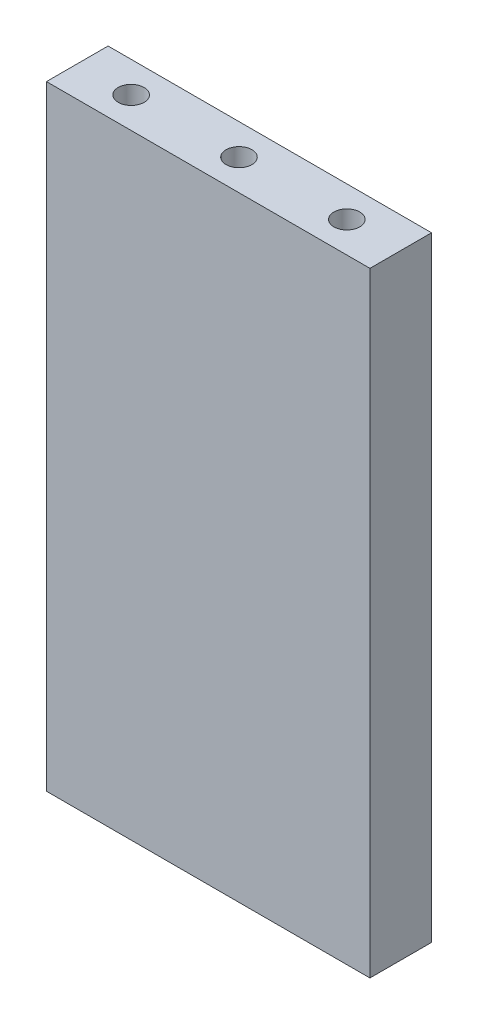
from build123d import *

# Parameters (mm, degrees)
SKETCH1_W                 = 50
SKETCH1_H                 = 95
BOSS_EXTRUDE1_DEPTH       = 9.525
F_4_0MM_DOWEL_HOLE1_D     = 4
F_4_0MM_DOWEL_HOLE1_DEPTH = 3.2
F_4_0MM_DOWEL_HOLE1_TIP   = 1.201721238
F_4_0MM_DOWEL_HOLE2_D     = 4
F_4_0MM_DOWEL_HOLE2_DEPTH = 3.2
F_4_0MM_DOWEL_HOLE2_TIP   = 1.201721238


with BuildPart() as part:
    # Sketch1 → Boss-Extrude1 (new body)
    with BuildSketch(Plane.XY):
        Rectangle(SKETCH1_W, SKETCH1_H)
    extrude(amount=-BOSS_EXTRUDE1_DEPTH)

    # Ø4.0mm Dowel Hole1
    with Locations(Plane(origin=(0, 47.5, 0), x_dir=(1, 0, 0), z_dir=(0, 1, 0))):
        with Locations((0, 4.7625), (16.67, 4.7625), (-16.67, 4.7625)):
            Hole(F_4_0MM_DOWEL_HOLE1_D / 2, depth=F_4_0MM_DOWEL_HOLE1_DEPTH)
            with Locations((0, 0, -(F_4_0MM_DOWEL_HOLE1_DEPTH + F_4_0MM_DOWEL_HOLE1_TIP / 2))):  # 118° drill point
                Cone(0, F_4_0MM_DOWEL_HOLE1_D / 2, F_4_0MM_DOWEL_HOLE1_TIP, mode=Mode.SUBTRACT)

    # Ø4.0mm Dowel Hole2
    with Locations(Plane.XZ.offset(47.5)):
        with Locations((16.67, -4.7625), (0, -4.7625), (-16.67, -4.7625)):
            Hole(F_4_0MM_DOWEL_HOLE2_D / 2, depth=F_4_0MM_DOWEL_HOLE2_DEPTH)
            with Locations((0, 0, -(F_4_0MM_DOWEL_HOLE2_DEPTH + F_4_0MM_DOWEL_HOLE2_TIP / 2))):  # 118° drill point
                Cone(0, F_4_0MM_DOWEL_HOLE2_D / 2, F_4_0MM_DOWEL_HOLE2_TIP, mode=Mode.SUBTRACT)


solid = part.part
